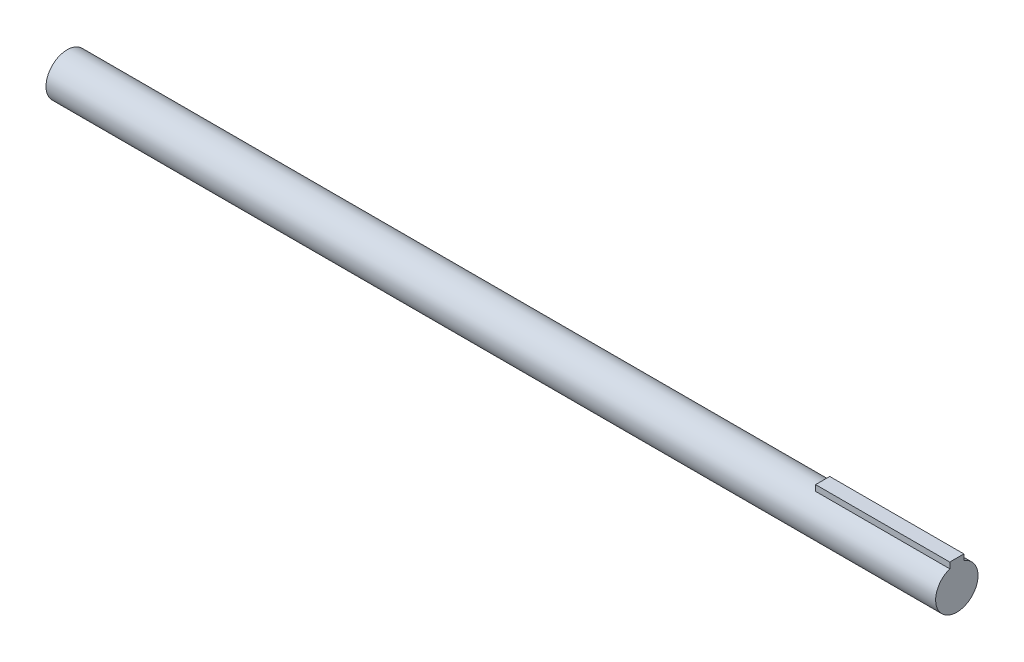
from build123d import *

# Parameters (mm, degrees)
SKETCH1_R           = 15
BOSS_EXTRUDE1_DEPTH = 590
BOSS_EXTRUDE3_START = -55
BOSS_EXTRUDE3_DEPTH = 55
BOSS_EXTRUDE4_DEPTH = 40


with BuildPart() as part:
    # Sketch1 → Boss-Extrude1 (new body)
    with BuildSketch(Plane(origin=(0, 0, 0), x_dir=(0, 0, -1), z_dir=(1, 0, 0))):
        Circle(SKETCH1_R)
    extrude(amount=BOSS_EXTRUDE1_DEPTH)

    # Sketch2 → Boss-Extrude3 (add)
    with BuildSketch(Plane(origin=(590, 0, 0), x_dir=(0, 0, -1), z_dir=(1, 0, 0)).offset(BOSS_EXTRUDE3_START)):
        with BuildLine():
            Line((5, 14.142135624), (5, 18.302135624))
            Line((5, 18.302135624), (-5, 18.302135624))
            Line((-5, 18.302135624), (-5, 14.142135624))
            ThreePointArc((-5, 14.142135624), (0, 15), (5, 14.142135624))
        make_face()
    extrude(amount=BOSS_EXTRUDE3_DEPTH)

    # Sketch3 → Boss-Extrude4 (add)
    with BuildSketch(Plane(origin=(590, 0, 0), x_dir=(0, 0, -1), z_dir=(1, 0, 0))):
        with BuildLine():
            Line((-5, 18.302135624), (-5, 14.142135624))
            ThreePointArc((-5, 14.142135624), (0, -15), (5, 14.142135624))
            Line((5, 14.142135624), (5, 18.302135624))
            Line((5, 18.302135624), (-5, 18.302135624))
        make_face()
    extrude(amount=BOSS_EXTRUDE4_DEPTH)


solid = part.part
